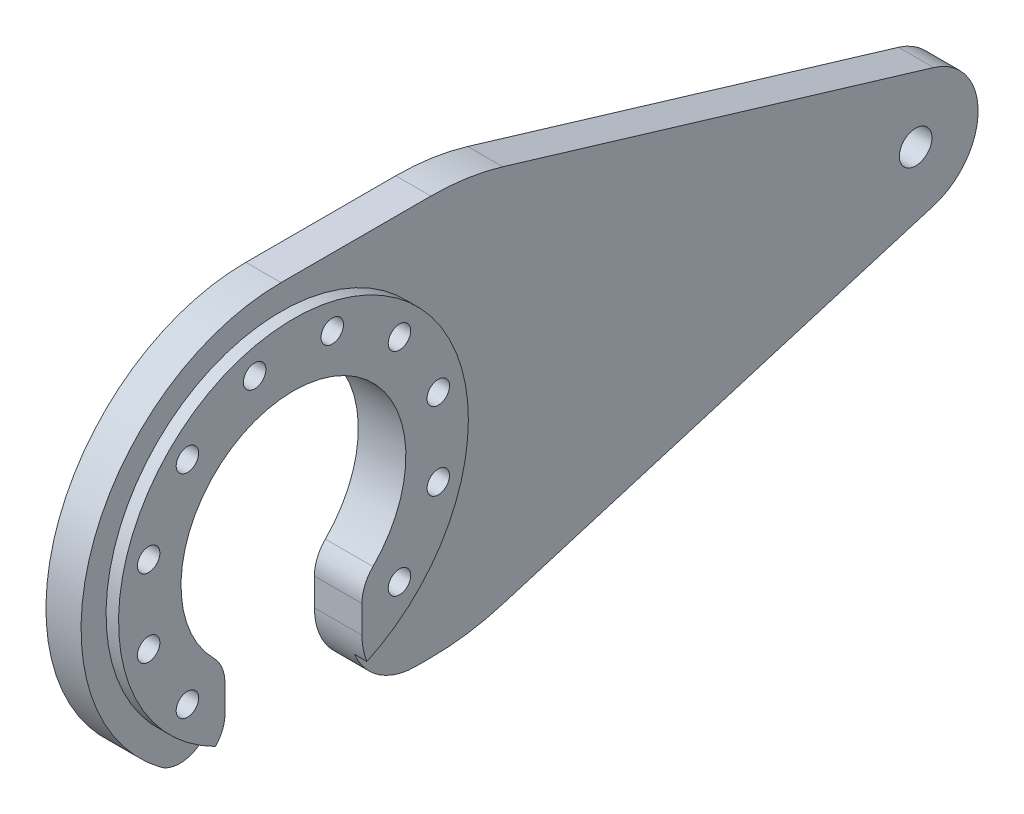
from build123d import *

# Parameters (mm, degrees)
SKETCH1_R           = 35
SKETCH1_R_2         = 22.5
SKETCH1_R_3         = 2.25
BOSS_EXTRUDE1_DEPTH = 2.5
SKETCH2_R           = 22.5
SKETCH2_R_2         = 2.25
SKETCH2_R_3         = 3.2639
BOSS_EXTRUDE2_DEPTH = 7.025
CUT_EXTRUDE1_DEPTH  = 146.433749952
SKETCH4_R           = 5
CUT_EXTRUDE2_DEPTH  = 4.525


with BuildPart() as part:
    # Sketch1 → Boss-Extrude1 (new body)
    with BuildSketch(Plane.ZY):
        Circle(SKETCH1_R)
        Circle(SKETCH1_R_2, mode=Mode.SUBTRACT)
        with Locations((-21.213203436, -21.213203436)):
            Circle(SKETCH1_R_3, mode=Mode.SUBTRACT)
        with Locations((-28.977774789, -7.764571353)):
            Circle(SKETCH1_R_3, mode=Mode.SUBTRACT)
        with Locations((-28.977774789, 7.764571353)):
            Circle(SKETCH1_R_3, mode=Mode.SUBTRACT)
        with Locations((-21.213203436, 21.213203436)):
            Circle(SKETCH1_R_3, mode=Mode.SUBTRACT)
        with Locations((-7.764571353, 28.977774789)):
            Circle(SKETCH1_R_3, mode=Mode.SUBTRACT)
        with Locations((7.764571353, 28.977774789)):
            Circle(SKETCH1_R_3, mode=Mode.SUBTRACT)
        with Locations((21.213203436, 21.213203436)):
            Circle(SKETCH1_R_3, mode=Mode.SUBTRACT)
        with Locations((28.977774789, 7.764571353)):
            Circle(SKETCH1_R_3, mode=Mode.SUBTRACT)
        with Locations((28.977774789, -7.764571353)):
            Circle(SKETCH1_R_3, mode=Mode.SUBTRACT)
        with Locations((21.213203436, -21.213203436)):
            Circle(SKETCH1_R_3, mode=Mode.SUBTRACT)
    extrude(amount=BOSS_EXTRUDE1_DEPTH)

    # Sketch2 → Boss-Extrude2 (add)
    with BuildSketch(Plane.ZY.offset(2.5)):
        with BuildLine():
            Line((0, 40), (-30, 40))
            ThreePointArc((-30, 40), (-37.274117863, 39.468042303), (-44.393454807, 37.883488373))
            Line((-44.393454807, 37.883488373), (-130.598363702, 11.970872093))
            ThreePointArc((-130.598363702, 11.970872093), (-139.5, 0), (-130.598363702, -11.970872093))
            Line((-130.598363702, -11.970872093), (-44.393454807, -37.883488373))
            ThreePointArc((-44.393454807, -37.883488373), (-37.274117863, -39.468042303), (-30, -40))
            Line((-30, -40), (0, -40))
            ThreePointArc((0, -40), (40, 0), (0, 40))
        make_face()
        Circle(SKETCH2_R, mode=Mode.SUBTRACT)
        with Locations((-21.213203436, -21.213203436)):
            Circle(SKETCH2_R_2, mode=Mode.SUBTRACT)
        with Locations((-28.977774789, -7.764571353)):
            Circle(SKETCH2_R_2, mode=Mode.SUBTRACT)
        with Locations((-28.977774789, 7.764571353)):
            Circle(SKETCH2_R_2, mode=Mode.SUBTRACT)
        with Locations((-21.213203436, 21.213203436)):
            Circle(SKETCH2_R_2, mode=Mode.SUBTRACT)
        with Locations((-7.764571353, 28.977774789)):
            Circle(SKETCH2_R_2, mode=Mode.SUBTRACT)
        with Locations((7.764571353, 28.977774789)):
            Circle(SKETCH2_R_2, mode=Mode.SUBTRACT)
        with Locations((21.213203436, 21.213203436)):
            Circle(SKETCH2_R_2, mode=Mode.SUBTRACT)
        with Locations((28.977774789, 7.764571353)):
            Circle(SKETCH2_R_2, mode=Mode.SUBTRACT)
        with Locations((28.977774789, -7.764571353)):
            Circle(SKETCH2_R_2, mode=Mode.SUBTRACT)
        with Locations((21.213203436, -21.213203436)):
            Circle(SKETCH2_R_2, mode=Mode.SUBTRACT)
        with Locations((-127, 0)):
            Circle(SKETCH2_R_3, mode=Mode.SUBTRACT)
    extrude(amount=BOSS_EXTRUDE2_DEPTH)

    # Sketch3 → Cut-Extrude1 (cut, through all)
    with BuildSketch(Plane(origin=(0, 0, 0), x_dir=(0, 0, -1), z_dir=(1, 0, 0))):
        with BuildLine():
            Line((26.998480774, -40), (0, -40))
            ThreePointArc((0, -40), (-12.729354805, -37.920489531), (-24.135168281, -31.898176312))
            ThreePointArc((-24.135168281, -31.898176312), (-17.31861983, -32.534635526), (-13.713203436, -26.714722661))
            Line((-13.713203436, -26.714722661), (-13.713203436, -21.213203436))
            ThreePointArc((-13.713203436, -21.213203436), (-14.284106942, -18.343077693), (-15.909902577, -15.909902577))
            ThreePointArc((-15.909902577, -15.909902577), (0, -22.5), (15.909902577, -15.909902577))
            ThreePointArc((15.909902577, -15.909902577), (14.284106942, -18.343077693), (13.713203436, -21.213203436))
            Line((13.713203436, -21.213203436), (13.713203436, -26.714722661))
            ThreePointArc((13.713203436, -26.714722661), (17.604371078, -36.108832357), (26.998480774, -40))
        make_face()
    extrude(amount=-CUT_EXTRUDE1_DEPTH, mode=Mode.SUBTRACT)

    # Sketch4 → Cut-Extrude2 (cut)
    with BuildSketch(Plane.ZY.offset(9.525)):
        with Locations((-21.213203436, -21.213203436)):
            Circle(SKETCH4_R)
        with Locations((-28.977774789, -7.764571353)):
            Circle(SKETCH4_R)
        with Locations((-28.977774789, 7.764571353)):
            Circle(SKETCH4_R)
        with Locations((-21.213203436, 21.213203436)):
            Circle(SKETCH4_R)
        with Locations((-7.764571353, 28.977774789)):
            Circle(SKETCH4_R)
        with Locations((7.764571353, 28.977774789)):
            Circle(SKETCH4_R)
        with Locations((21.213203436, 21.213203436)):
            Circle(SKETCH4_R)
        with Locations((28.977774789, 7.764571353)):
            Circle(SKETCH4_R)
        with Locations((28.977774789, -7.764571353)):
            Circle(SKETCH4_R)
        with Locations((21.213203436, -21.213203436)):
            Circle(SKETCH4_R)
    extrude(amount=-CUT_EXTRUDE2_DEPTH, mode=Mode.SUBTRACT)


solid = part.part
